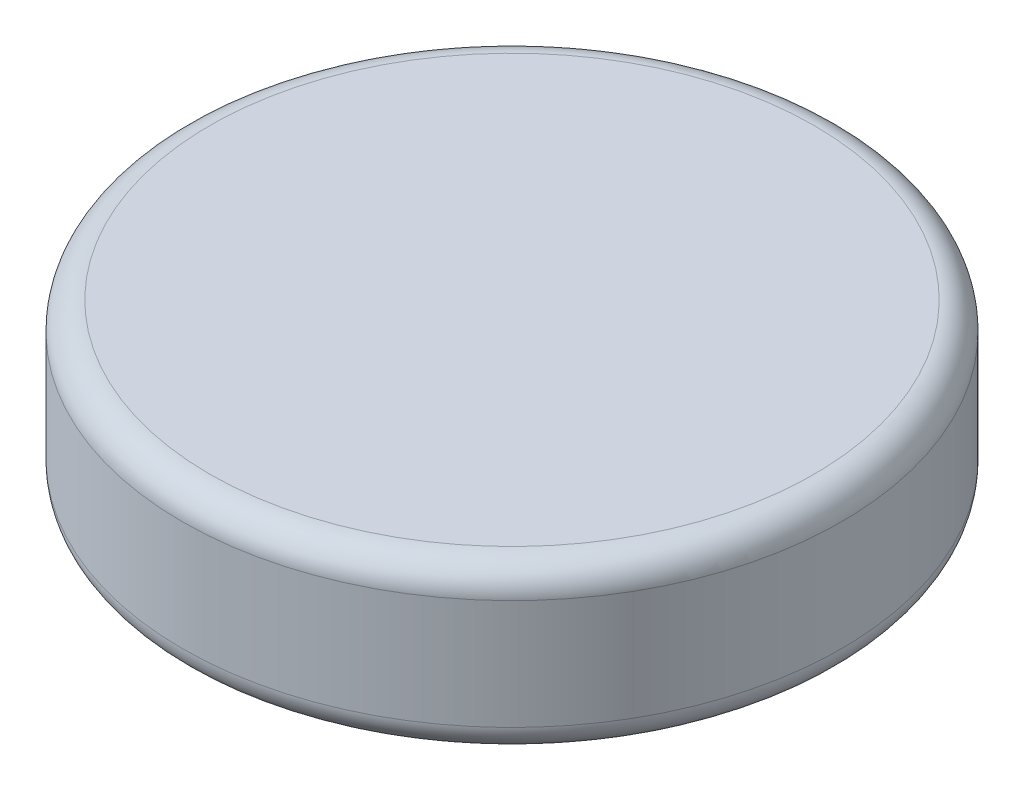
from build123d import *

# Parameters (mm, degrees)
SKETCH1_R           = 6
BOSS_EXTRUDE1_DEPTH = 3
FILLET1_R           = 0.5


with BuildPart() as part:
    # Sketch1 → Boss-Extrude1 (new body)
    with BuildSketch(Plane(origin=(0, 0, 0), x_dir=(1, 0, 0), z_dir=(0, 1, 0))):
        with Locations(Location((0, 0, 0), (0, 0, 270))):
            Circle(SKETCH1_R)
    extrude(amount=BOSS_EXTRUDE1_DEPTH)

    # Fillet1
    fillet1_edges = [part.edges().sort_by_distance(p)[0] for p in [
        (0, 0, -6),
        (0, 3, -6),
    ]]
    fillet(fillet1_edges, radius=FILLET1_R)


solid = part.part
